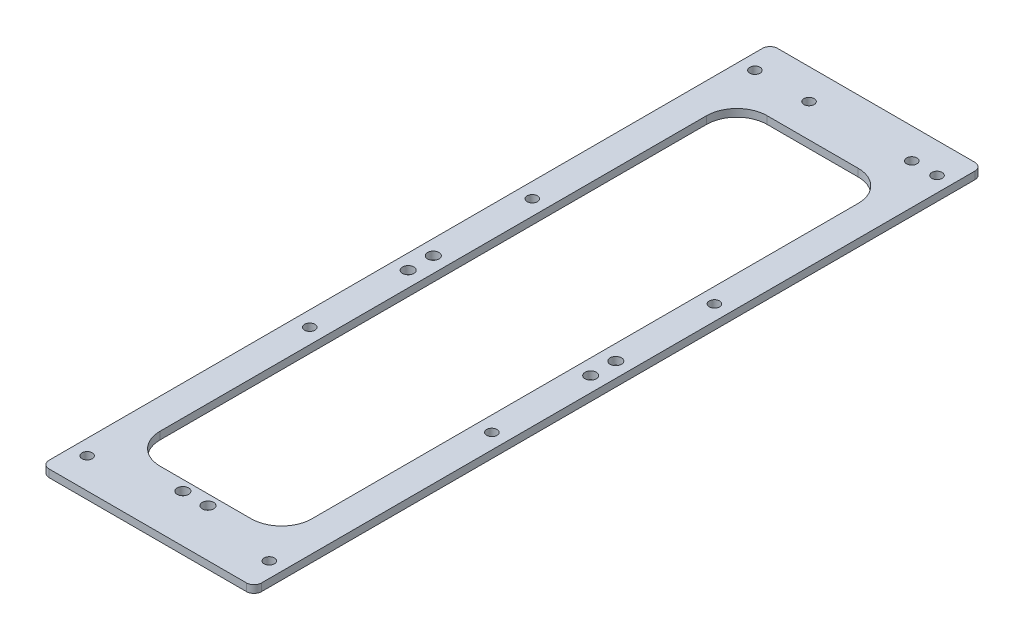
from build123d import *

# Parameters (mm, degrees)
SKETCH1_W                             = 88.9
SKETCH1_H                             = 304.8
SKETCH1_W_2                           = 63.5
SKETCH1_H_2                           = 254
BOSS_EXTRUDE1_DEPTH                   = 3.175
SKETCH7_R                             = 2.159
CUT_EXTRUDE2_DEPTH                    = 159.781746826
FILLET1_R                             = 12.7
FILLET3_R                             = 3.175
SKETCH9_R                             = 2.159
CUT_EXTRUDE4_DEPTH                    = 159.781746826
SKETCH10_R                            = 2.38125
SONAR_HOLES_DEPTH                     = 159.781746826
SKETCH11_R                            = 2.38125
SONAR_HOLES_2_ELECTRIC_BOOGALOO_DEPTH = 159.781746826


with BuildPart() as part:
    # Sketch1 → Boss-Extrude1 (new body)
    with BuildSketch(Plane(origin=(0, 0, 0), x_dir=(1, 0, 0), z_dir=(0, 1, 0))):
        Rectangle(SKETCH1_W, SKETCH1_H)
        with Locations((0, -1.176932577)):
            Rectangle(SKETCH1_W_2, SKETCH1_H_2, mode=Mode.SUBTRACT)
    extrude(amount=BOSS_EXTRUDE1_DEPTH)

    # Sketch7 → Cut-Extrude2 (cut, through all)
    with BuildSketch(Plane(origin=(0, 3.175, 0), x_dir=(1, 0, 0), z_dir=(0, 1, 0))):
        with Locations(Location((-38.1, 139.736298381, 0), (0, 0, 270))):
            Circle(SKETCH7_R)
        with Locations(Location((38.1, 139.736298381, 0), (0, 0, 90))):
            Circle(SKETCH7_R)
        with Locations(Location((-38.1, 46.602880381, 0), (0, 0, 270))):
            Circle(SKETCH7_R)
        with Locations(Location((-38.1, -46.530537619, 0), (0, 0, 270))):
            Circle(SKETCH7_R)
        with Locations(Location((-38.1, -139.663955619, 0), (0, 0, 270))):
            Circle(SKETCH7_R)
        with Locations(Location((38.1, 46.602118381, 0), (0, 0, 90))):
            Circle(SKETCH7_R)
        with Locations(Location((38.1, -46.532061619, 0), (0, 0, 90))):
            Circle(SKETCH7_R)
        with Locations(Location((38.1, -139.666241619, 0), (0, 0, 90))):
            Circle(SKETCH7_R)
    extrude(amount=-CUT_EXTRUDE2_DEPTH, mode=Mode.SUBTRACT)

    # Fillet1
    fillet1_edges = [part.edges().sort_by_distance(p)[0] for p in [
        (-31.75, 1.5875, -125.823067423),
        (-31.75, 1.5875, 128.176932577),
        (31.75, 1.5875, 128.176932577),
        (31.75, 1.5875, -125.823067423),
    ]]
    fillet(fillet1_edges, radius=FILLET1_R)

    # Fillet3
    fillet3_edges = [part.edges().sort_by_distance(p)[0] for p in [
        (-44.45, 1.5875, -152.4),
        (44.45, 1.5875, -152.4),
        (44.45, 1.5875, 152.4),
        (-44.45, 1.5875, 152.4),
    ]]
    fillet(fillet3_edges, radius=FILLET3_R)

    # Sketch9 → Cut-Extrude4 (cut, through all)
    with BuildSketch(Plane(origin=(0, 3.175, 0), x_dir=(1, 0, 0), z_dir=(0, 1, 0))):
        with Locations(Location((-15.4178, 139.7, 0), (0, 0, 270))):
            Circle(SKETCH9_R)
        with Locations(Location((27.5844, 139.7, 0), (0, 0, 270))):
            Circle(SKETCH9_R)
    extrude(amount=-CUT_EXTRUDE4_DEPTH, mode=Mode.SUBTRACT)

    # Sketch10 → Sonar Holes (cut, through all)
    with BuildSketch(Plane(origin=(0, 3.175, 0), x_dir=(1, 0, 0), z_dir=(0, 1, 0))):
        with Locations(Location((-5.246249985, -132.458232577, 0), (0, 0, 270))):
            Circle(SKETCH10_R)
        with Locations(Location((5.246249985, -132.458232577, 0), (0, 0, 90))):
            Circle(SKETCH10_R)
    extrude(amount=-SONAR_HOLES_DEPTH, mode=Mode.SUBTRACT)

    # Sketch11 → Sonar Holes 2: Electric Boogaloo (cut, through all)
    with BuildSketch(Plane(origin=(0, 3.175, 0), x_dir=(1, 0, 0), z_dir=(0, 1, 0))):
        with Locations(Location((-38.181117115, 5.24625, 0), (0, 0, 270))):
            Circle(SKETCH11_R)
        with Locations(Location((-38.181117115, -5.24625, 0), (0, 0, 90))):
            Circle(SKETCH11_R)
        with Locations(Location((38.181117115, -5.24625, 0), (0, 0, 270))):
            Circle(SKETCH11_R)
        with Locations(Location((38.181117115, 5.24625, 0), (0, 0, 90))):
            Circle(SKETCH11_R)
    extrude(amount=-SONAR_HOLES_2_ELECTRIC_BOOGALOO_DEPTH, mode=Mode.SUBTRACT)


solid = part.part
